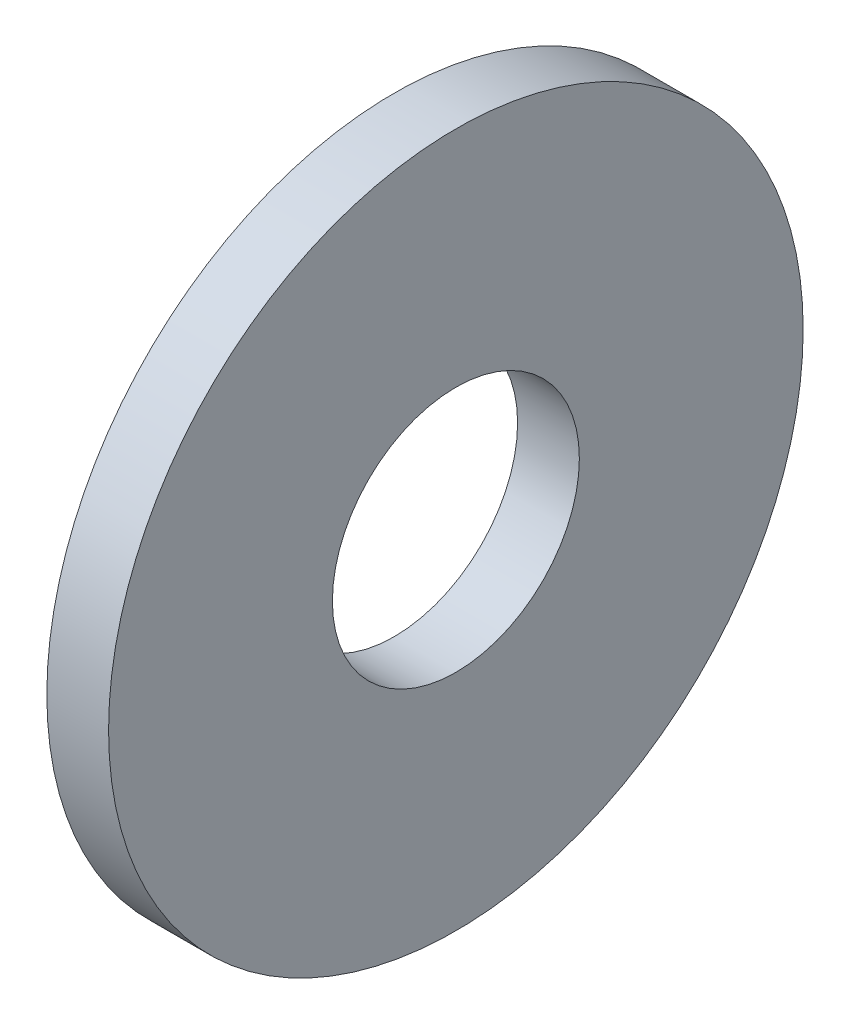
from build123d import *

# Parameters (mm, degrees)
SKETCH1_W = 1.6
SKETCH1_H = 5.8


with BuildPart() as part:
    # Sketch1 → Base-Revolve (revolve)
    with BuildSketch(Plane.XY, mode=Mode.PRIVATE) as base_revolve_sk:
        with Locations((-0.8, 6.1)):
            Rectangle(SKETCH1_W, SKETCH1_H)
    revolve(base_revolve_sk.sketch.rotate(Axis((-34.925, 0, 0), (1, 0, 0)), 90), axis=Axis((-34.925, 0, 0), (1, 0, 0)))


solid = part.part
